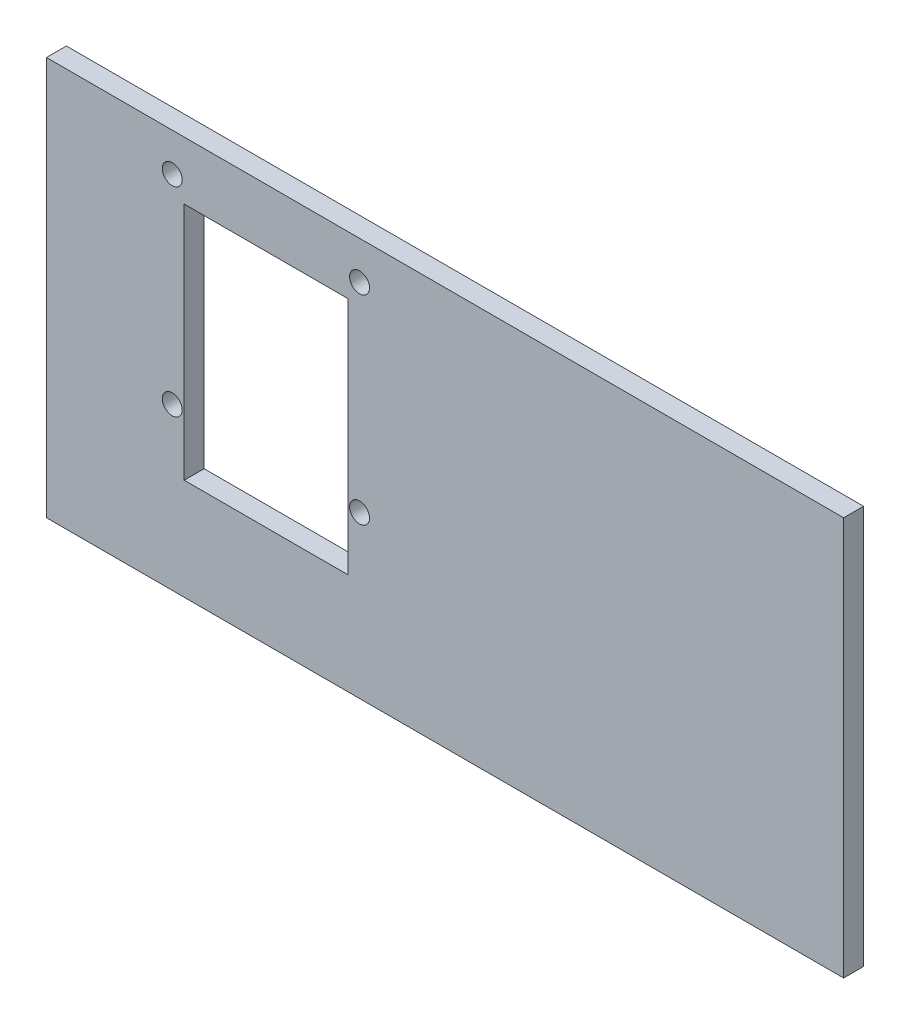
from build123d import *

# Parameters (mm, degrees)
SKETCH1_W           = 254
SKETCH1_H           = 127
BOSS_EXTRUDE1_DEPTH = 6.35
SKETCH4_W           = 52.216720723
SKETCH4_H           = 76.2
SKETCH4_R           = 3.175
CUT_EXTRUDE3_DEPTH  = 285.051619429


with BuildPart() as part:
    # Sketch1 → Boss-Extrude1 (new body)
    with BuildSketch(Plane.XY):
        with Locations((127, 63.5)):
            Rectangle(SKETCH1_W, SKETCH1_H)
    extrude(amount=BOSS_EXTRUDE1_DEPTH)

    # Sketch4 → Cut-Extrude3 (cut, through all)
    with BuildSketch(Plane.XY.offset(6.35)):
        with Locations((69.998360362, 70.4)):
            Rectangle(SKETCH4_W, SKETCH4_H)
        with Locations((99.77, 114.85)):
            Circle(SKETCH4_R)
        with Locations((40.08, 51.35)):
            Circle(SKETCH4_R)
        with Locations((99.77, 51.35)):
            Circle(SKETCH4_R)
        with Locations((40.08, 114.85)):
            Circle(SKETCH4_R)
    extrude(amount=-CUT_EXTRUDE3_DEPTH, mode=Mode.SUBTRACT)


solid = part.part
